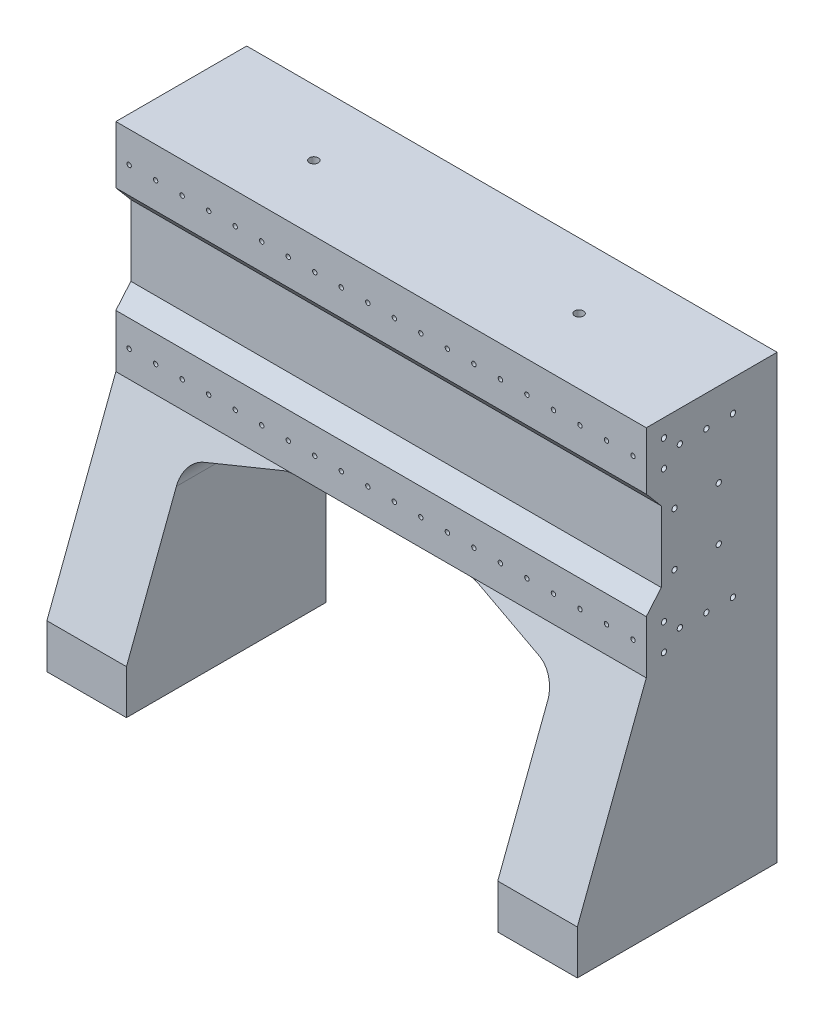
from build123d import *

# Parameters (mm, degrees)
SKETCH1_W                  = 600
SKETCH1_H                  = 500
BOSS_EXTRUDE1_DEPTH        = 226
SKETCH2_OUTSIDE_W          = 764.614
SKETCH2_OUTSIDE_H          = 664.614
CUT_EXTRUDE1_DEPTH         = 452.193971591
CUT_EXTRUDE8_DEPTH         = 452.193971591
CUT_EXTRUDE2_DEPTH         = 689.168583997
CUT_EXTRUDE3_DEPTH         = 689.168583997
SKETCH7_R                  = 2.5
CUT_EXTRUDE5_DEPTH         = 25
SKETCH8_R                  = 10
CUT_EXTRUDE6_DEPTH         = 35
F_6_0MM_DOWEL_HOLE1_D      = 6
F_6_0MM_DOWEL_HOLE1_DEPTH  = 28.197418143
F_6_0MM_DOWEL_HOLE1_TIP    = 1.802581857
F_6_0MM_DOWEL_HOLE2_D      = 6
F_6_0MM_DOWEL_HOLE2_DEPTH  = 28.197418143
F_6_0MM_DOWEL_HOLE2_TIP    = 1.802581857
F_6_0MM_DOWEL_HOLE3_D      = 6
F_6_0MM_DOWEL_HOLE3_DEPTH  = 28.197418143
F_6_0MM_DOWEL_HOLE3_TIP    = 1.802581857
FILLET2_R                  = 30
F_6_0MM_DOWEL_HOLE4_D      = 6
F_6_0MM_DOWEL_HOLE4_DEPTH  = 28
F_6_0MM_DOWEL_HOLE4_TIP    = 1.802581857
F_10_0MM_DOWEL_HOLE1_D     = 10
F_10_0MM_DOWEL_HOLE1_DEPTH = 28
F_10_0MM_DOWEL_HOLE1_TIP   = 3.004303095


with BuildPart() as part:
    # Sketch1 → Boss-Extrude1 (new body)
    with BuildSketch(Plane.XY):
        Rectangle(SKETCH1_W, SKETCH1_H)
    extrude(amount=BOSS_EXTRUDE1_DEPTH)

    # Sketch2 outside → Cut-Extrude1 (cut, through all)
    with BuildSketch(Plane.XY.offset(226)):
        Rectangle(SKETCH2_OUTSIDE_W, SKETCH2_OUTSIDE_H)
        Polygon((-210, -250), (-210, -225), (-210, -30), (210, -30), (210, -225), (210, -250), (300, -250), (300, 250), (-300, 250), (-300, -250), align=None, mode=Mode.SUBTRACT)
    extrude(amount=-CUT_EXTRUDE1_DEPTH, mode=Mode.SUBTRACT)

    # Sketch22 → Cut-Extrude8 (cut, through all)
    with BuildSketch(Plane.XY.offset(226)):
        Polygon((-210, -30), (210, -30), (105, 5), (0, 5), (-105, 5), align=None)
    extrude(amount=-CUT_EXTRUDE8_DEPTH, mode=Mode.SUBTRACT)

    # Sketch4 → Cut-Extrude2 (cut, through all)
    with BuildSketch(Plane.ZY.offset(300)):
        Polygon((148, 25), (148, 5), (226, -200), (226, -165), (226, -145), (226, 250), (148, 250), align=None)
    extrude(amount=-CUT_EXTRUDE2_DEPTH, mode=Mode.SUBTRACT)

    # Sketch5 → Cut-Extrude3 (cut, through all)
    with BuildSketch(Plane.ZY.offset(300)):
        Polygon((131, 160), (131, 165), (148, 185), (148, 65), (131, 85), (131, 90), (131, 125), align=None)
    extrude(amount=-CUT_EXTRUDE3_DEPTH, mode=Mode.SUBTRACT)

    # Sketch7 → Cut-Extrude5 (cut)
    with BuildSketch(Plane.XY.offset(148)):
        with Locations((-285, 215)):
            Circle(SKETCH7_R)
        with Locations((-255, 215)):
            Circle(SKETCH7_R)
        with Locations((-225, 215)):
            Circle(SKETCH7_R)
        with Locations((-195, 215)):
            Circle(SKETCH7_R)
        with Locations((-165, 215)):
            Circle(SKETCH7_R)
        with Locations((-135, 215)):
            Circle(SKETCH7_R)
        with Locations((-105, 215)):
            Circle(SKETCH7_R)
        with Locations((-75, 215)):
            Circle(SKETCH7_R)
        with Locations((-45, 215)):
            Circle(SKETCH7_R)
        with Locations((-15, 215)):
            Circle(SKETCH7_R)
        with Locations((15, 215)):
            Circle(SKETCH7_R)
        with Locations((45, 215)):
            Circle(SKETCH7_R)
        with Locations((75, 215)):
            Circle(SKETCH7_R)
        with Locations((105, 215)):
            Circle(SKETCH7_R)
        with Locations((135, 215)):
            Circle(SKETCH7_R)
        with Locations((165, 215)):
            Circle(SKETCH7_R)
        with Locations((195, 215)):
            Circle(SKETCH7_R)
        with Locations((225, 215)):
            Circle(SKETCH7_R)
        with Locations((255, 215)):
            Circle(SKETCH7_R)
        with Locations((285, 215)):
            Circle(SKETCH7_R)
        with Locations((-255, 35)):
            Circle(SKETCH7_R)
        with Locations((-225, 35)):
            Circle(SKETCH7_R)
        with Locations((-195, 35)):
            Circle(SKETCH7_R)
        with Locations((-165, 35)):
            Circle(SKETCH7_R)
        with Locations((-135, 35)):
            Circle(SKETCH7_R)
        with Locations((-105, 35)):
            Circle(SKETCH7_R)
        with Locations((-75, 35)):
            Circle(SKETCH7_R)
        with Locations((-45, 35)):
            Circle(SKETCH7_R)
        with Locations((-15, 35)):
            Circle(SKETCH7_R)
        with Locations((15, 35)):
            Circle(SKETCH7_R)
        with Locations((45, 35)):
            Circle(SKETCH7_R)
        with Locations((75, 35)):
            Circle(SKETCH7_R)
        with Locations((105, 35)):
            Circle(SKETCH7_R)
        with Locations((135, 35)):
            Circle(SKETCH7_R)
        with Locations((165, 35)):
            Circle(SKETCH7_R)
        with Locations((195, 35)):
            Circle(SKETCH7_R)
        with Locations((225, 35)):
            Circle(SKETCH7_R)
        with Locations((255, 35)):
            Circle(SKETCH7_R)
        with Locations((285, 35)):
            Circle(SKETCH7_R)
        with Locations((-285, 35)):
            Circle(SKETCH7_R)
    extrude(amount=-CUT_EXTRUDE5_DEPTH, mode=Mode.SUBTRACT)

    # Sketch8 → Cut-Extrude6 (cut)
    with BuildSketch(Plane.XZ.offset(250)):
        with Locations((240, 171)):
            Circle(SKETCH8_R)
        with Locations((275, 171)):
            Circle(SKETCH8_R)
        with Locations((240, 51)):
            Circle(SKETCH8_R)
        with Locations((275, 51)):
            Circle(SKETCH8_R)
        with Locations((-275, 51)):
            Circle(SKETCH8_R)
        with Locations((-240, 51)):
            Circle(SKETCH8_R)
        with Locations((-275, 171)):
            Circle(SKETCH8_R)
        with Locations((-240, 171)):
            Circle(SKETCH8_R)
    extrude(amount=-CUT_EXTRUDE6_DEPTH, mode=Mode.SUBTRACT)

    # Ø6.0mm Dowel Hole1
    with Locations(Plane.ZY.offset(300)):
        with Locations((116, 95), (66, 95), (66, 155), (116, 155), (128, 230), (128, 200), (128, 50), (128, 20)):
            Hole(F_6_0MM_DOWEL_HOLE1_D / 2, depth=F_6_0MM_DOWEL_HOLE1_DEPTH)
            with Locations((0, 0, -(F_6_0MM_DOWEL_HOLE1_DEPTH + F_6_0MM_DOWEL_HOLE1_TIP / 2))):  # 118° drill point
                Cone(0, F_6_0MM_DOWEL_HOLE1_D / 2, F_6_0MM_DOWEL_HOLE1_TIP, mode=Mode.SUBTRACT)

    # Ø6.0mm Dowel Hole2
    with Locations(Plane(origin=(300, 0, 0), x_dir=(0, 0, -1), z_dir=(1, 0, 0))):
        with Locations((-128, 230), (-128, 200), (-116, 155), (-66, 155), (-66, 95), (-116, 95), (-128, 50), (-128, 20)):
            Hole(F_6_0MM_DOWEL_HOLE2_D / 2, depth=F_6_0MM_DOWEL_HOLE2_DEPTH)
            with Locations((0, 0, -(F_6_0MM_DOWEL_HOLE2_DEPTH + F_6_0MM_DOWEL_HOLE2_TIP / 2))):  # 118° drill point
                Cone(0, F_6_0MM_DOWEL_HOLE2_D / 2, F_6_0MM_DOWEL_HOLE2_TIP, mode=Mode.SUBTRACT)

    # Ø6.0mm Dowel Hole3
    with Locations(Plane(origin=(300, 0, 0), x_dir=(0, 0, -1), z_dir=(1, 0, 0))):
        with Locations((-110, 215), (-80, 215), (-50, 215), (-50, 35), (-80, 35), (-110, 35)):
            Hole(F_6_0MM_DOWEL_HOLE3_D / 2, depth=F_6_0MM_DOWEL_HOLE3_DEPTH)
            with Locations((0, 0, -(F_6_0MM_DOWEL_HOLE3_DEPTH + F_6_0MM_DOWEL_HOLE3_TIP / 2))):  # 118° drill point
                Cone(0, F_6_0MM_DOWEL_HOLE3_D / 2, F_6_0MM_DOWEL_HOLE3_TIP, mode=Mode.SUBTRACT)

    # Fillet2
    fillet2_edges = [part.edges().sort_by_distance(p)[0] for p in [
        (210, -30, 80.658536585),
        (-210, -30, 80.658536585),
        (-105, 5, 74),
        (105, 5, 74),
    ]]
    fillet(fillet2_edges, radius=FILLET2_R)

    # Ø6.0mm Dowel Hole4
    with Locations(Plane.ZY.offset(300)):
        with Locations((110, 215), (80, 215), (50, 215), (110, 35), (80, 35), (50, 35)):
            Hole(F_6_0MM_DOWEL_HOLE4_D / 2, depth=F_6_0MM_DOWEL_HOLE4_DEPTH)
            with Locations((0, 0, -(F_6_0MM_DOWEL_HOLE4_DEPTH + F_6_0MM_DOWEL_HOLE4_TIP / 2))):  # 118° drill point
                Cone(0, F_6_0MM_DOWEL_HOLE4_D / 2, F_6_0MM_DOWEL_HOLE4_TIP, mode=Mode.SUBTRACT)

    # Ø10.0mm Dowel Hole1
    with Locations(Plane(origin=(0, 250, 0), x_dir=(1, 0, 0), z_dir=(0, 1, 0))):
        with Locations((-150, -74), (150, -74)):
            Hole(F_10_0MM_DOWEL_HOLE1_D / 2, depth=F_10_0MM_DOWEL_HOLE1_DEPTH)
            with Locations((0, 0, -(F_10_0MM_DOWEL_HOLE1_DEPTH + F_10_0MM_DOWEL_HOLE1_TIP / 2))):  # 118° drill point
                Cone(0, F_10_0MM_DOWEL_HOLE1_D / 2, F_10_0MM_DOWEL_HOLE1_TIP, mode=Mode.SUBTRACT)


solid = part.part
